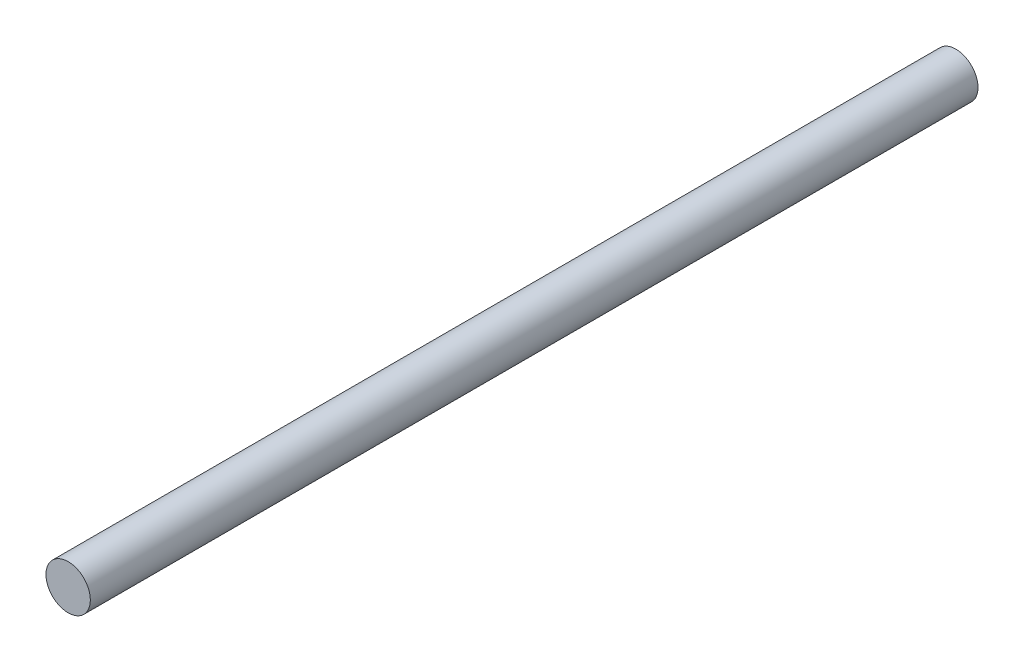
from build123d import *

# Parameters (mm, degrees)
SNS_KABLO_D5_START = -40
SKETCH1_R          = 2.5
SNS_KABLO_D5_DEPTH = 100


with BuildPart() as part:
    # Sketch1 → SNS_kablo_D5 (new body)
    with BuildSketch(Plane.XY.offset(SNS_KABLO_D5_START)):
        Circle(SKETCH1_R)
    extrude(amount=-SNS_KABLO_D5_DEPTH)


solid = part.part
